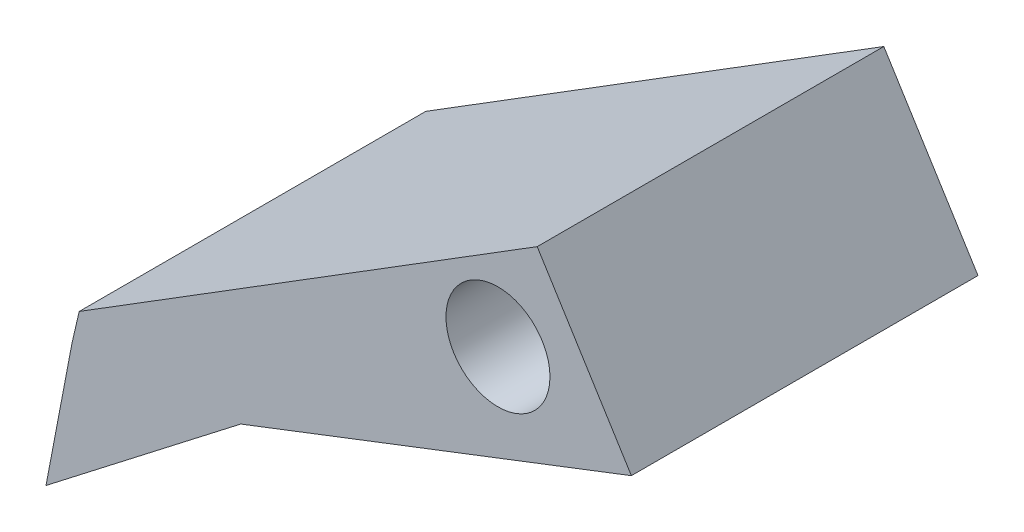
from build123d import *

# Parameters (mm, degrees)
SKETCH_1_R      = 1.5
EXTRUDE_1_DEPTH = 10


with BuildPart() as part:
    # 草图1 → 凸台-拉伸1 (new body)
    with BuildSketch(Plane.XY):
        Polygon((0, 18.091268752), (0.752978388, 22.037503228), (0.958016554, 22.91889134), (14.171072765, 31.144621906), (16.888151818, 26.780156286), (5.618724226, 22.435712519), align=None)
        with Locations((13.039346851, 28.075285518)):
            Circle(SKETCH_1_R, mode=Mode.SUBTRACT)
    extrude(amount=EXTRUDE_1_DEPTH)


solid = part.part
